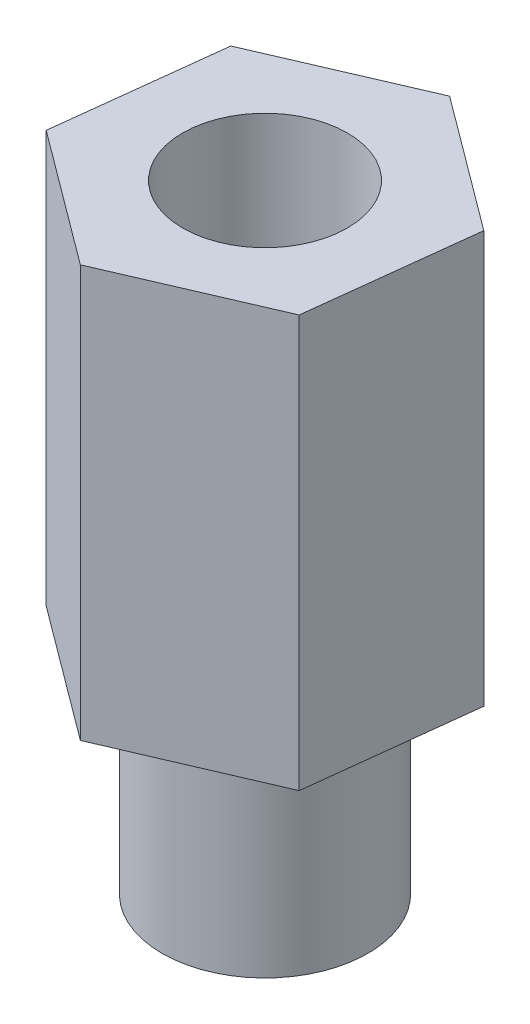
from build123d import *

# Parameters (mm, degrees)
SKETCH_1_R          = 5
EXTRUDE_1_DEPTH     = 10
EXTRUDE_2_DEPTH     = 20
SKETCH_3_R          = 4
CUT_EXTRUDE_1_DEPTH = 32.930052519


with BuildPart() as part:
    # 草图1 → 凸台-拉伸1 (new body)
    with BuildSketch(Plane(origin=(0, 0, 0), x_dir=(1, 0, 0), z_dir=(0, 1, 0))):
        with Locations(Location((0, 0, 0), (0, 0, 270))):
            Circle(SKETCH_1_R)
    extrude(amount=EXTRUDE_1_DEPTH)

    # 草图2 → 凸台-拉伸2 (add)
    with BuildSketch(Plane(origin=(0, 10, 0), x_dir=(1, 0, 0), z_dir=(0, 1, 0))):
        Polygon((7.421020472, 3.203402641), (0.93628217, 8.028493572), (-6.484738302, 4.82509093), (-7.421020472, -3.203402641), (-0.93628217, -8.028493572), (6.484738302, -4.82509093), align=None)
    extrude(amount=EXTRUDE_2_DEPTH)

    # 草图3 → 切除-拉伸1 (cut, through all)
    with BuildSketch(Plane(origin=(0, 30, 0), x_dir=(1, 0, 0), z_dir=(0, 1, 0))):
        with Locations(Location((0, 0, 0), (0, 0, 270))):
            Circle(SKETCH_3_R)
    extrude(amount=-CUT_EXTRUDE_1_DEPTH, mode=Mode.SUBTRACT)


solid = part.part
